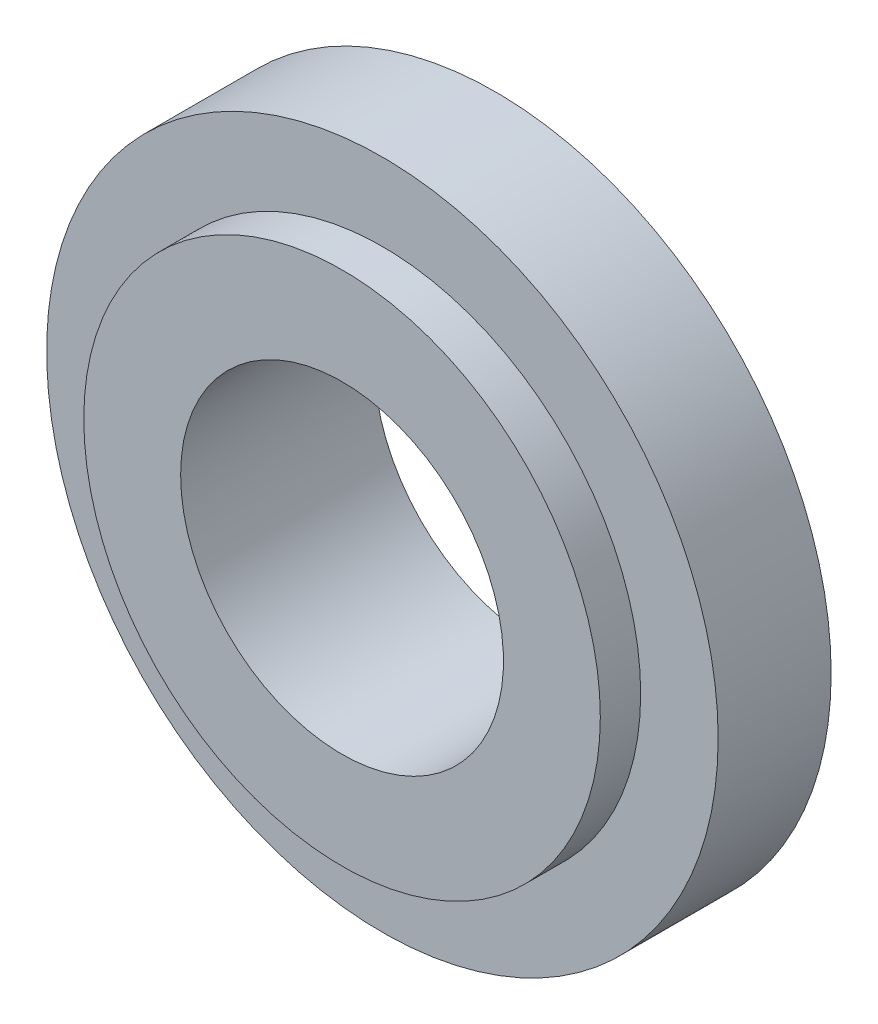
from build123d import *

# Parameters (mm, degrees)
SKETCH1_R           = 12.7
SKETCH1_R_2         = 7.9375
BOSS_EXTRUDE1_DEPTH = 9.525
SKETCH2_R           = 16.51
SKETCH2_R_2         = 7.9375
BOSS_EXTRUDE2_DEPTH = 2.778125


with BuildPart() as part:
    # Sketch1 → Boss-Extrude1 (new body)
    with BuildSketch(Plane.XY):
        with Locations(Location((0, 0, 0), (0, 0, 180))):
            Circle(SKETCH1_R)
        with Locations(Location((0, 0, 0), (0, 0, 180))):
            Circle(SKETCH1_R_2, mode=Mode.SUBTRACT)
    extrude(amount=BOSS_EXTRUDE1_DEPTH)

    # Sketch2 → Boss-Extrude2 (add, symmetric)
    with BuildSketch(Plane.XY.offset(4.7625)):
        Circle(SKETCH2_R)
        with Locations(Location((0, 0, 0), (0, 0, 180))):
            Circle(SKETCH2_R_2, mode=Mode.SUBTRACT)
    extrude(amount=BOSS_EXTRUDE2_DEPTH, both=True)


solid = part.part
